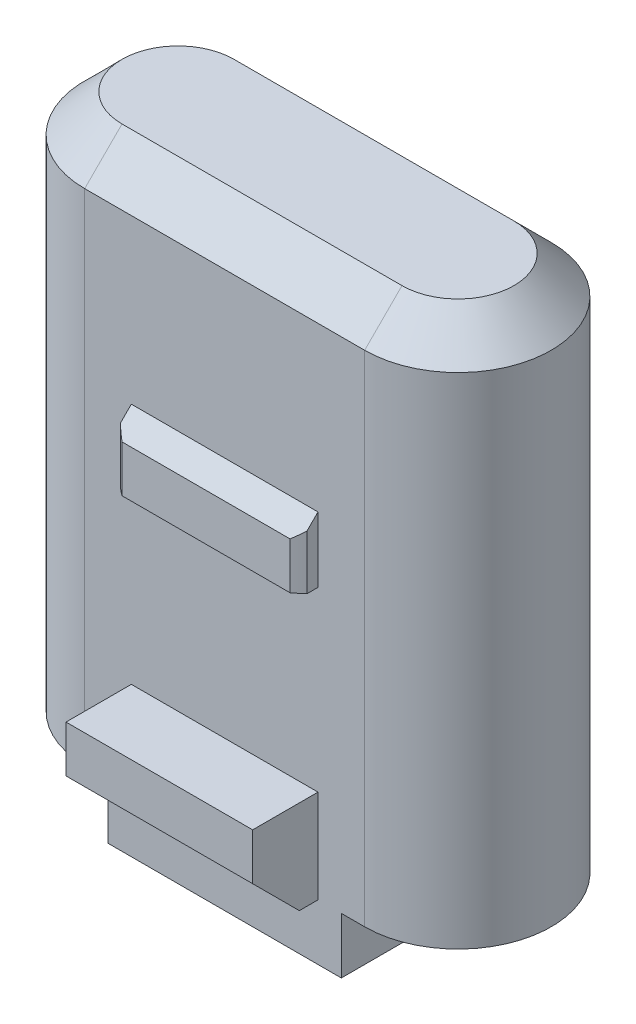
from build123d import *

# Parameters (mm, degrees)
EXTRUDE_1_DEPTH      = 12.7
CUT_EXTRUDE_1_REACH  = 17.534
SKETCH_3_W           = 2.5
SKETCH_3_H           = 1.2
EXTRUDE_2_DEPTH      = 2
EXTRUDE_2_DEPTH_BACK = 2
SKETCH_5_W           = 1.4
SKETCH_5_H           = 2
CUT_EXTRUDE_2_REACH  = 17.39
CHAMFER_1_SIZE       = 1
CHAMFER_2_SIZE       = 0.8


with BuildPart() as part:
    # 草图2 → 凸台-拉伸1 (new body)
    with BuildSketch(Plane(origin=(0, 0, 0), x_dir=(1, 0, 0), z_dir=(0, 1, 0))):
        with BuildLine():
            Line((0, 2), (6, 2))
            ThreePointArc((6, 2), (8, 0), (6, -2))
            Line((6, -2), (0, -2))
            ThreePointArc((0, -2), (-2, 0), (0, 2))
        make_face()
    extrude(amount=EXTRUDE_1_DEPTH)

    # 草图3 → 切除-拉伸1 (cut, up to next)
    with BuildSketch(Plane.XY.offset(2), mode=Mode.PRIVATE) as cut_extrude_1_sk1:
        with Locations((-0.75, 0.6)):
            Rectangle(SKETCH_3_W, SKETCH_3_H)
    cut_extrude_1_tool1 = extrude(cut_extrude_1_sk1.sketch, amount=-CUT_EXTRUDE_1_REACH, mode=Mode.PRIVATE) & part.part
    # 草图3 → 切除-拉伸1 (cut, up to next)
    with BuildSketch(Plane.XY.offset(2), mode=Mode.PRIVATE) as cut_extrude_1_sk2:
        with Locations((6.75, 0.6)):
            Rectangle(SKETCH_3_W, SKETCH_3_H)
    cut_extrude_1_tool2 = extrude(cut_extrude_1_sk2.sketch, amount=-CUT_EXTRUDE_1_REACH, mode=Mode.PRIVATE) & part.part
    add(cut_extrude_1_tool1.solids().sort_by_distance((-0.75, 0.6, 2))[0], mode=Mode.SUBTRACT)
    add(cut_extrude_1_tool2.solids().sort_by_distance((6.75, 0.6, 2))[0], mode=Mode.SUBTRACT)

    # 草图5 → 凸台-拉伸2 (add, two sides: drawn at the far end of the back side and taken through both)
    with BuildSketch(Plane.ZY.offset(-3).offset(-EXTRUDE_2_DEPTH_BACK)):
        Polygon((-2, 7), (-2.4, 7), (-2.4, 8), (-2, 8.4), align=None)
        Polygon((2, 8.4), (2, 7), (2.4, 7), (2.4, 8), align=None)
        with Locations((-2.7, 2.2)):
            Rectangle(SKETCH_5_W, SKETCH_5_H)
        with Locations((2.7, 2.2)):
            Rectangle(SKETCH_5_W, SKETCH_5_H)
    extrude(amount=EXTRUDE_2_DEPTH + EXTRUDE_2_DEPTH_BACK)

    # 草图6 → 切除-拉伸2 (cut, up to next)
    with BuildSketch(Plane(origin=(0, 12.7, 0), x_dir=(1, 0, 0), z_dir=(0, 1, 0)), mode=Mode.PRIVATE) as cut_extrude_2_sk1:
        with BuildLine():
            Line((1.2, 2.4), (1, 2.4))
            Line((1, 2.4), (1, 2.236067977))
            ThreePointArc((1, 2.236067977), (1.098232815, 2.320189986), (1.2, 2.4))
        make_face()
    cut_extrude_2_tool1 = extrude(cut_extrude_2_sk1.sketch, amount=-CUT_EXTRUDE_2_REACH, mode=Mode.PRIVATE) & part.part
    # 草图6 → 切除-拉伸2 (cut, up to next)
    with BuildSketch(Plane(origin=(0, 12.7, 0), x_dir=(1, 0, 0), z_dir=(0, 1, 0)), mode=Mode.PRIVATE) as cut_extrude_2_sk2:
        with BuildLine():
            Line((4.8, -2.4), (5, -2.4))
            Line((5, -2.4), (5, -2.236067977))
            ThreePointArc((5, -2.236067977), (4.901767185, -2.320189986), (4.8, -2.4))
        make_face()
    cut_extrude_2_tool2 = extrude(cut_extrude_2_sk2.sketch, amount=-CUT_EXTRUDE_2_REACH, mode=Mode.PRIVATE) & part.part
    # 草图6 → 切除-拉伸2 (cut, up to next)
    with BuildSketch(Plane(origin=(0, 12.7, 0), x_dir=(1, 0, 0), z_dir=(0, 1, 0)), mode=Mode.PRIVATE) as cut_extrude_2_sk3:
        with BuildLine():
            Line((5, 2.4), (4.8, 2.4))
            ThreePointArc((4.8, 2.4), (4.901767185, 2.320189986), (5, 2.236067977))
            Line((5, 2.236067977), (5, 2.4))
        make_face()
    cut_extrude_2_tool3 = extrude(cut_extrude_2_sk3.sketch, amount=-CUT_EXTRUDE_2_REACH, mode=Mode.PRIVATE) & part.part
    # 草图6 → 切除-拉伸2 (cut, up to next)
    with BuildSketch(Plane(origin=(0, 12.7, 0), x_dir=(1, 0, 0), z_dir=(0, 1, 0)), mode=Mode.PRIVATE) as cut_extrude_2_sk4:
        with BuildLine():
            Line((1, -2.236067977), (1, -2.4))
            Line((1, -2.4), (1.2, -2.4))
            ThreePointArc((1.2, -2.4), (1.098232815, -2.320189986), (1, -2.236067977))
        make_face()
    cut_extrude_2_tool4 = extrude(cut_extrude_2_sk4.sketch, amount=-CUT_EXTRUDE_2_REACH, mode=Mode.PRIVATE) & part.part
    add(cut_extrude_2_tool1.solids().sort_by_distance((1.065681, 12.7, -2.346155))[0], mode=Mode.SUBTRACT)
    add(cut_extrude_2_tool2.solids().sort_by_distance((4.934319, 12.7, 2.346155))[0], mode=Mode.SUBTRACT)
    add(cut_extrude_2_tool3.solids().sort_by_distance((4.934319, 12.7, -2.346155))[0], mode=Mode.SUBTRACT)
    add(cut_extrude_2_tool4.solids().sort_by_distance((1.065681, 12.7, 2.346155))[0], mode=Mode.SUBTRACT)

    # 倒角1
    chamfer_1_edges = [part.edges().sort_by_distance(p)[0] for p in [
        (3, 1.2, -3.4),
        (3, 1.2, 3.4),
    ]]
    chamfer(chamfer_1_edges, length=CHAMFER_1_SIZE)

    # 倒角2
    chamfer_2_edges = [part.edges().sort_by_distance(p)[0] for p in [
        (8, 12.7, 0),
        (3, 12.7, -2),
        (-2, 12.7, 0),
        (3, 12.7, 2),
    ]]
    chamfer(chamfer_2_edges, length=CHAMFER_2_SIZE)


solid = part.part
